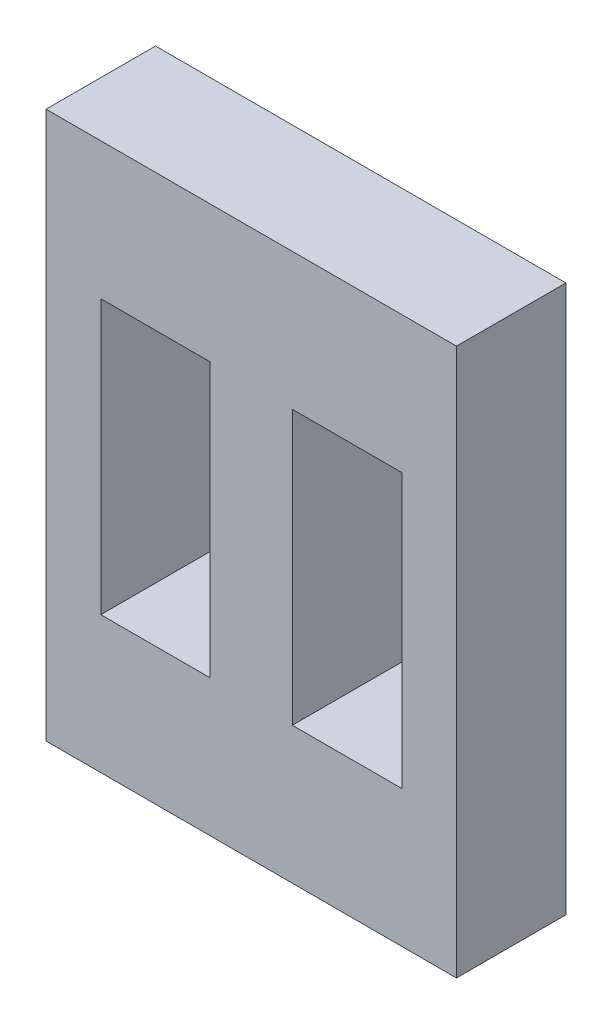
from build123d import *

# Parameters (mm, degrees)
SKETCH_1_W      = 4
SKETCH_1_H      = 10
EXTRUDE_1_DEPTH = 2


with BuildPart() as part:
    # 草图1 → 凸台-拉伸1 (new, symmetric)
    with BuildSketch(Plane.XY):
        Polygon((-46, 0), (-37, 0), (-37, 20), (-46, 20), (-52, 20), (-52, 0), align=None)
        with Locations((-48, 10)):
            Rectangle(SKETCH_1_W, SKETCH_1_H, mode=Mode.SUBTRACT)
        with Locations((-41, 10)):
            Rectangle(SKETCH_1_W, SKETCH_1_H, mode=Mode.SUBTRACT)
    extrude(amount=EXTRUDE_1_DEPTH, both=True)


solid = part.part
